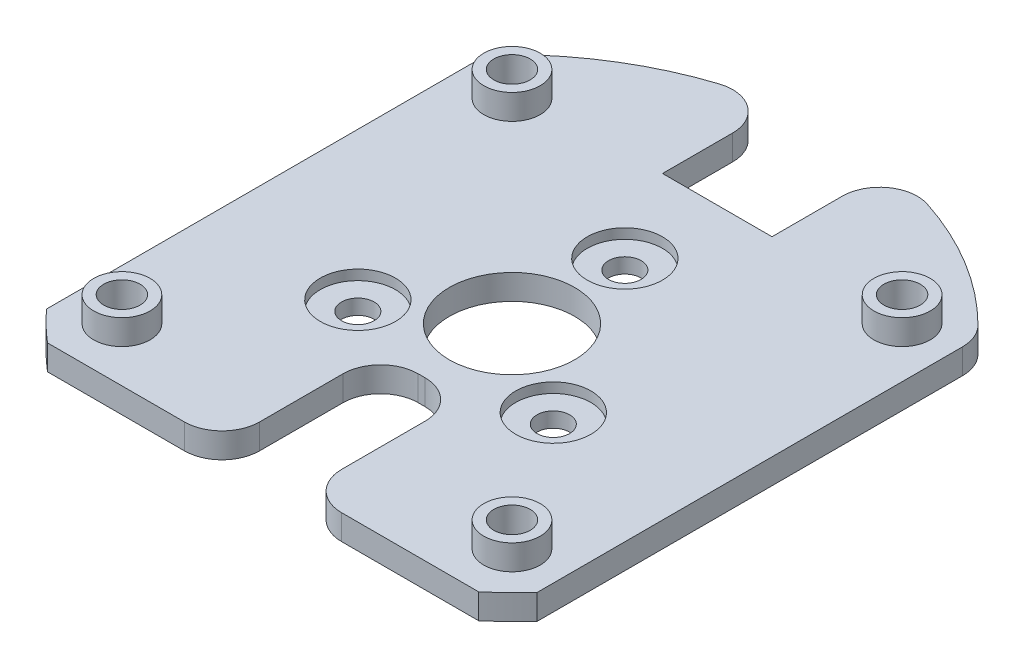
from build123d import *

# Parameters (mm, degrees)
SKETCH_1_R          = 1.3
SKETCH_1_R_2        = 5
SKETCH_1_R_3        = 1.45
EXTRUDE_1_DEPTH     = 2
SKETCH_2_R          = 3
CUT_EXTRUDE_1_DEPTH = 0.8
SKETCH_4_W          = 8.73447759
SKETCH_4_H          = 10.120774017
CUT_EXTRUDE_2_DEPTH = 33.667542419
SKETCH_8_R          = 2.25
SKETCH_8_R_2        = 1.45
EXTRUDE_2_DEPTH     = 2
CUT_EXTRUDE_4_DEPTH = 1
FILLET_3_R          = 3


with BuildPart() as part:
    # 草图1 → 凸台-拉伸1 (new body)
    with BuildSketch(Plane(origin=(0, 0, 0), x_dir=(1, 0, 0), z_dir=(0, 1, 0))):
        with BuildLine():
            Line((-19.570385791, 15.556349186), (-19.570385791, -15.556349186))
            Line((-19.570385791, -15.556349186), (-19.570385791, -17.556349186))
            ThreePointArc((-19.570385791, -17.556349186), (-10.696991496, -23.91128764), (0, -26.07848445))
            ThreePointArc((0, -26.07848445), (10.696991496, -23.91128764), (19.570385791, -17.556349186))
            Line((19.570385791, -17.556349186), (19.570385791, -15.556349186))
            Line((19.570385791, -15.556349186), (19.570385791, 15.556349186))
            Line((19.570385791, 15.556349186), (19.570385791, 17.556349186))
            ThreePointArc((19.570385791, 17.556349186), (10.696991496, 23.91128764), (0, 26.07848445))
            ThreePointArc((0, 26.07848445), (-10.696991496, 23.91128764), (-19.570385791, 17.556349186))
            Line((-19.570385791, 17.556349186), (-19.570385791, 15.556349186))
        make_face()
        with Locations(Location((0, 9, 0), (0, 0, 270))):
            Circle(SKETCH_1_R, mode=Mode.SUBTRACT)
        with Locations(Location((7.794228634, -4.5, 0), (0, 0, 270))):
            Circle(SKETCH_1_R, mode=Mode.SUBTRACT)
        with Locations(Location((-7.794228634, -4.5, 0), (0, 0, 270))):
            Circle(SKETCH_1_R, mode=Mode.SUBTRACT)
        with Locations(Location((0, 0, 0), (0, 0, 270))):
            Circle(SKETCH_1_R_2, mode=Mode.SUBTRACT)
        with Locations(Location((-15.556349186, 15.556349186, 0), (0, 0, 270))):
            Circle(SKETCH_1_R_3, mode=Mode.SUBTRACT)
        with Locations(Location((15.556349186, 15.556349186, 0), (0, 0, 270))):
            Circle(SKETCH_1_R_3, mode=Mode.SUBTRACT)
        with Locations(Location((15.556349186, -15.556349186, 0), (0, 0, 270))):
            Circle(SKETCH_1_R_3, mode=Mode.SUBTRACT)
        with Locations(Location((-15.556349186, -15.556349186, 0), (0, 0, 270))):
            Circle(SKETCH_1_R_3, mode=Mode.SUBTRACT)
    extrude(amount=EXTRUDE_1_DEPTH)

    # 草图2 → 切除-拉伸1 (cut)
    with BuildSketch(Plane(origin=(0, 2, 0), x_dir=(1, 0, 0), z_dir=(0, 1, 0))):
        with Locations(Location((0, 9, 0), (0, 0, 270))):
            Circle(SKETCH_2_R)
        with Locations(Location((7.794228634, -4.5, 0), (0, 0, 270))):
            Circle(SKETCH_2_R)
        with Locations(Location((-7.794228634, -4.5, 0), (0, 0, 270))):
            Circle(SKETCH_2_R)
    extrude(amount=-CUT_EXTRUDE_1_DEPTH, mode=Mode.SUBTRACT)

    # 草图4 → 切除-拉伸2 (cut, through all)
    with BuildSketch(Plane(origin=(0, 2, 0), x_dir=(1, 0, 0), z_dir=(0, 1, 0))):
        Polygon((-3.274193367, -19.855122702), (-3.274193367, -7.205990029), (3.274193367, -7.205990029), (3.274193367, -19.855122702), (19.611727687, -19.855122702), (19.611727687, -26.506793376), (-19.611727687, -26.506793376), (-19.611727687, -19.855122702), align=None)
        with Locations((0, 21.431925769)):
            Rectangle(SKETCH_4_W, SKETCH_4_H)
    extrude(amount=-CUT_EXTRUDE_2_DEPTH, mode=Mode.SUBTRACT)

    # 草图8 → 凸台-拉伸2 (add)
    # profile 1 of 4: a face of its own
    with BuildSketch(Plane(origin=(0, 2, 0), x_dir=(1, 0, 0), z_dir=(0, 1, 0))):
        with Locations(Location((-15.556349186, 15.556349186, 0), (0, 0, 270))):
            Circle(SKETCH_8_R)
        with Locations(Location((-15.556349186, 15.556349186, 0), (0, 0, 270))):
            Circle(SKETCH_8_R_2, mode=Mode.SUBTRACT)
    # profile 2 of 4: a face of its own
    with BuildSketch(Plane(origin=(0, 2, 0), x_dir=(1, 0, 0), z_dir=(0, 1, 0))):
        with Locations(Location((15.556349186, 15.556349186, 0), (0, 0, 270))):
            Circle(SKETCH_8_R)
        with Locations(Location((15.556349186, 15.556349186, 0), (0, 0, 270))):
            Circle(SKETCH_8_R_2, mode=Mode.SUBTRACT)
    # profile 3 of 4: a face of its own
    with BuildSketch(Plane(origin=(0, 2, 0), x_dir=(1, 0, 0), z_dir=(0, 1, 0))):
        with Locations(Location((15.556349186, -15.556349186, 0), (0, 0, 270))):
            Circle(SKETCH_8_R)
        with Locations(Location((15.556349186, -15.556349186, 0), (0, 0, 270))):
            Circle(SKETCH_8_R_2, mode=Mode.SUBTRACT)
    # profile 4 of 4: a face of its own
    with BuildSketch(Plane(origin=(0, 2, 0), x_dir=(1, 0, 0), z_dir=(0, 1, 0))):
        with Locations(Location((-15.556349186, -15.556349186, 0), (0, 0, 270))):
            Circle(SKETCH_8_R)
        with Locations(Location((-15.556349186, -15.556349186, 0), (0, 0, 270))):
            Circle(SKETCH_8_R_2, mode=Mode.SUBTRACT)
    extrude(amount=EXTRUDE_2_DEPTH)

    # 草图7 → 切除-拉伸4 (cut)
    with BuildSketch(Plane.XZ):
        Polygon((-18.732353017, 15.556349186), (-17.144351102, 12.805849186), (-13.968347271, 12.805849186), (-12.380345355, 15.556349186), (-13.968347271, 18.306849186), (-17.144351102, 18.306849186), align=None)
        Polygon((12.380345355, 15.556349186), (13.968347271, 12.805849186), (17.144351102, 12.805849186), (18.732353017, 15.556349186), (17.144351102, 18.306849186), (13.968347271, 18.306849186), align=None)
        Polygon((-18.732353017, -15.556349186), (-17.144351102, -18.306849186), (-13.968347271, -18.306849186), (-12.380345355, -15.556349186), (-13.968347271, -12.805849186), (-17.144351102, -12.805849186), align=None)
        Polygon((12.380345355, -15.556349186), (13.968347271, -18.306849186), (17.144351102, -18.306849186), (18.732353017, -15.556349186), (17.144351102, -12.805849186), (13.968347271, -12.805849186), align=None)
    extrude(amount=-CUT_EXTRUDE_4_DEPTH, mode=Mode.SUBTRACT)

    # 圆角3
    fillet_3_edges = [part.edges().sort_by_distance(p)[0] for p in [
        (3.274193367, 1, 19.855122702),
        (-3.274193367, 1, 7.205990029),
        (3.274193367, 1, 7.205990029),
        (-3.274193367, 1, 19.855122702),
        (19.570385791, 1, -17.556349186),
        (-19.570385791, 1, -17.556349186),
        (-4.367238795, 1, -25.758495538),
        (4.367238795, 1, -25.758495538),
    ]]
    fillet(fillet_3_edges, radius=FILLET_3_R)


solid = part.part
